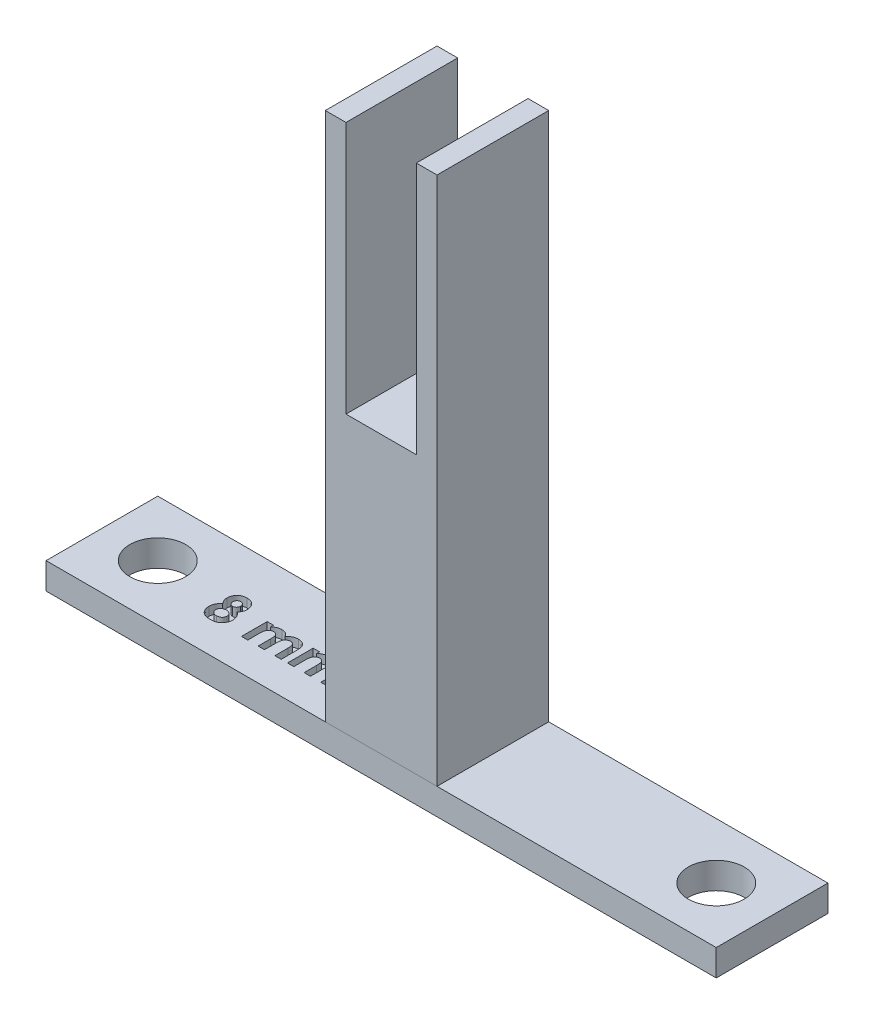
from build123d import *

# Parameters (mm, degrees)
SKETCH1_W           = 12.7
SKETCH1_H           = 80.2
BOSS_EXTRUDE1_DEPTH = 12.7
SKETCH4_W           = 76.2
SKETCH4_H           = 12.7
BOSS_EXTRUDE3_DEPTH = 3
CUT_EXTRUDE5_DEPTH  = 23
SKETCH17_R          = 3.175
CUT_EXTRUDE9_DEPTH  = 3
SKETCH18_R          = 3.175
CUT_EXTRUDE10_DEPTH = 3
SKETCH19_W          = 12.7
SKETCH19_H          = 12.7
CUT_EXTRUDE11_DEPTH = 20
CUT_EXTRUDE12_DEPTH = 1


with BuildPart() as part:
    # Sketch1 → Boss-Extrude1 (new body)
    with BuildSketch(Plane.XY):
        with Locations((6.35, 40.1)):
            Rectangle(SKETCH1_W, SKETCH1_H)
    extrude(amount=BOSS_EXTRUDE1_DEPTH)

    # Sketch4 → Boss-Extrude3 (add)
    with BuildSketch(Plane(origin=(0, 0, 0), x_dir=(-1, 0, 0), z_dir=(0, -1, 0))):
        with Locations((-6.347630067, -6.349948063)):
            Rectangle(SKETCH4_W, SKETCH4_H)
    extrude(amount=BOSS_EXTRUDE3_DEPTH)

    # Sketch12 → Cut-Extrude5 (cut)
    with BuildSketch(Plane.XY.offset(12.7)):
        with BuildLine():
            Line((2.35, 31.479187253), (2.35, 62.124358121))
            ThreePointArc((2.35, 62.124358121), (6.35, 70.085423211), (10.35, 62.124358121))
            Line((10.35, 62.124358121), (10.35, 31.479187253))
            Line((10.35, 31.479187253), (2.35, 31.479187253))
        make_face()
    extrude(amount=-CUT_EXTRUDE5_DEPTH, mode=Mode.SUBTRACT)

    # Sketch17 → Cut-Extrude9 (cut)
    with BuildSketch(Plane(origin=(0, 0, 0), x_dir=(1, 0, 0), z_dir=(0, 1, 0))):
        with Locations(Location((-25.402369933, -6.349948063, 0), (0, 0, 270))):
            Circle(SKETCH17_R)
    extrude(amount=-CUT_EXTRUDE9_DEPTH, mode=Mode.SUBTRACT)

    # Sketch18 → Cut-Extrude10 (cut)
    with BuildSketch(Plane(origin=(0, 0, 0), x_dir=(1, 0, 0), z_dir=(0, 1, 0))):
        with Locations(Location((38.1, -6.349948063, 0), (0, 0, 270))):
            Circle(SKETCH18_R)
    extrude(amount=-CUT_EXTRUDE10_DEPTH, mode=Mode.SUBTRACT)

    # Sketch19 → Cut-Extrude11 (cut)
    with BuildSketch(Plane(origin=(0, 80.2, 0), x_dir=(1, 0, 0), z_dir=(0, 1, 0))):
        with Locations((6.35, -6.35)):
            Rectangle(SKETCH19_W, SKETCH19_H)
    extrude(amount=-CUT_EXTRUDE11_DEPTH, mode=Mode.SUBTRACT)

    # Sketch20 → Cut-Extrude12 (cut)
    # profile 1 of 3: a face of its own
    with BuildSketch(Plane(origin=(0, 0, 0), x_dir=(1, 0, 0), z_dir=(0, 1, 0))):
        with BuildLine():
            Line((-7.948717949, -6.132650635), (-7.230769231, -6.132650635))
            Line((-7.230769231, -6.132650635), (-7.230769231, -6.482009609))
            add(Edge.make_bspline(
                [(-7.230769231, -6.482009609), (-7.198835237, -6.449779032), (-7.135959827, -6.386319675), (-7.031762973, -6.304736966), (-6.923075104, -6.234973671), (-6.808579094, -6.178495893), (-6.688554997, -6.135371031), (-6.563571664, -6.103769767), (-6.432987129, -6.085126012), (-6.344076709, -6.082634943), (-6.298878205, -6.081368583)],
                knots=[0, 0, 0, 0, 1.041528618, 2.050684245, 3.032913108, 4.004406485, 4.976926473, 5.95771665, 6.961784757, 8, 8, 8, 8], degree=3))
            add(Edge.make_bspline(
                [(-6.298878205, -6.081368583), (-6.253620023, -6.082792155), (-6.164530756, -6.085594409), (-6.034550134, -6.111237661), (-5.911414263, -6.15289928), (-5.796477925, -6.2122828), (-5.688910429, -6.28561836), (-5.593477085, -6.376694706), (-5.507575607, -6.481886288), (-5.461786812, -6.561412254), (-5.438301282, -6.602201917)],
                knots=[0, 0, 0, 0, 1.023965777, 2.015643508, 2.987309376, 3.958410333, 4.93654923, 5.924956801, 6.93568961, 8, 8, 8, 8], degree=3))
            add(Edge.make_bspline(
                [(-5.438301282, -6.602201917), (-5.408048884, -6.56130129), (-5.348671917, -6.481024839), (-5.243420834, -6.37621483), (-5.129613012, -6.285608863), (-5.00504653, -6.211741385), (-4.873029444, -6.153101976), (-4.734139443, -6.111392457), (-4.58963575, -6.085637266), (-4.491293058, -6.082803298), (-4.44150641, -6.081368583)],
                knots=[0, 0, 0, 0, 1.041189987, 2.043563759, 3.033412161, 4.015238574, 5.00275396, 5.986226558, 6.980513695, 8, 8, 8, 8], degree=3))
            add(Edge.make_bspline(
                [(-4.44150641, -6.081368583), (-4.390082716, -6.082858314), (-4.289939851, -6.085759425), (-4.144818459, -6.114301282), (-4.008894715, -6.158402733), (-3.885172495, -6.222581139), (-3.773298931, -6.298603002), (-3.677969158, -6.388426005), (-3.598854158, -6.488915841), (-3.547340147, -6.582748828), (-3.514037723, -6.665707933), (-3.493929423, -6.737897899), (-3.475121942, -6.818507127), (-3.461610649, -6.908619117), (-3.448998452, -7.007386887), (-3.441676577, -7.115467079), (-3.436699822, -7.232495595), (-3.436171227, -7.313466988), (-3.435897436, -7.355407045)],
                knots=[0, 0, 0, 0, 1.321991808, 2.574456155, 3.791773975, 4.987670122, 6.148905103, 7.262530793, 8.344737981, 9.427709016, 10.004683293, 10.642050061, 11.354108788, 12.133887687, 12.985666279, 13.916212488, 14.92067847, 16, 16, 16, 16], degree=3))
            Line((-3.435897436, -7.355407045), (-3.435897436, -9.055727558))
            Line((-3.435897436, -9.055727558), (-4.153846154, -9.055727558))
            Line((-4.153846154, -9.055727558), (-4.153846154, -7.58777884))
            add(Edge.make_bspline(
                [(-4.153846154, -7.58777884), (-4.15444371, -7.54851394), (-4.155590666, -7.473148514), (-4.160466815, -7.365051198), (-4.171381722, -7.267016261), (-4.184175393, -7.178500681), (-4.202483382, -7.099973777), (-4.22480665, -7.031246251), (-4.250701506, -6.972219172), (-4.281968764, -6.922898691), (-4.316988129, -6.881363056), (-4.355942122, -6.845758792), (-4.398424586, -6.815381308), (-4.444820688, -6.789488821), (-4.496345886, -6.771977219), (-4.551260772, -6.758236991), (-4.609995071, -6.748879798), (-4.650603952, -6.748321949), (-4.671474359, -6.74803525)],
                knots=[0, 0, 0, 0, 1.669139205, 3.203761885, 4.596586177, 5.860166715, 7.002923539, 8.018877315, 8.928339525, 9.734594377, 10.491888885, 11.231098709, 11.971440889, 12.708030942, 13.480072485, 14.275788656, 15.113863979, 16, 16, 16, 16], degree=3))
            add(Edge.make_bspline(
                [(-4.671474359, -6.74803525), (-4.70363536, -6.749147139), (-4.766744926, -6.751329), (-4.858708425, -6.772179128), (-4.945246756, -6.806266855), (-5.026035709, -6.852640188), (-5.099336887, -6.910559605), (-5.163456862, -6.979257556), (-5.216411019, -7.059129953), (-5.253067177, -7.133235517), (-5.275972672, -7.200241837), (-5.292130417, -7.257627368), (-5.304724736, -7.322521917), (-5.314582401, -7.39426825), (-5.324039679, -7.473271957), (-5.328679367, -7.559433135), (-5.333427184, -7.652632086), (-5.333365377, -7.717044551), (-5.333333333, -7.750439096)],
                knots=[0, 0, 0, 0, 1.129913425, 2.217230253, 3.297175357, 4.391411011, 5.481605898, 6.571841268, 7.681894157, 8.841607612, 9.468549532, 10.170608623, 10.93710061, 11.791434153, 12.717934886, 13.734733707, 14.825576123, 16, 16, 16, 16], degree=3))
            Line((-5.333333333, -7.750439096), (-5.333333333, -9.055727558))
            Line((-5.333333333, -9.055727558), (-6.051282051, -9.055727558))
            Line((-6.051282051, -9.055727558), (-6.051282051, -7.65428525))
            add(Edge.make_bspline(
                [(-6.051282051, -7.65428525), (-6.05134233, -7.623031241), (-6.051458288, -7.562908652), (-6.054943742, -7.476090483), (-6.059559165, -7.39592581), (-6.06602945, -7.322191039), (-6.07349165, -7.254977879), (-6.084261324, -7.194654031), (-6.09557586, -7.140887094), (-6.114974786, -7.079809458), (-6.142310366, -7.012125215), (-6.183150122, -6.940349845), (-6.232530966, -6.880254888), (-6.289204798, -6.831372676), (-6.353248661, -6.794128354), (-6.423040123, -6.766423207), (-6.499911809, -6.751468819), (-6.552825139, -6.749203926), (-6.580128205, -6.74803525)],
                knots=[0, 0, 0, 0, 1.256487322, 2.417074606, 3.49288742, 4.484586665, 5.393016842, 6.210437544, 6.947749329, 7.599905853, 8.784490193, 9.876739139, 10.906602197, 11.896672079, 12.869113195, 13.872201355, 14.902064413, 16, 16, 16, 16], degree=3))
            add(Edge.make_bspline(
                [(-6.580128205, -6.74803525), (-6.610978321, -6.749082356), (-6.672077232, -6.751156159), (-6.761077131, -6.773430499), (-6.846169288, -6.80689278), (-6.925481763, -6.854559535), (-6.997678654, -6.913841973), (-7.061156651, -6.984493979), (-7.113832514, -7.06643175), (-7.150651382, -7.14258141), (-7.173222887, -7.211259445), (-7.18981509, -7.270135046), (-7.201940821, -7.336458718), (-7.212057871, -7.409485765), (-7.221459159, -7.489302385), (-7.226118044, -7.576259582), (-7.230861169, -7.670260971), (-7.230800616, -7.735207097), (-7.230769231, -7.768868583)],
                knots=[0, 0, 0, 0, 1.07893236, 2.136834559, 3.195274846, 4.273923004, 5.364443877, 6.458052972, 7.587287137, 8.767908, 9.410170275, 10.118584836, 10.909717261, 11.770069756, 12.702352573, 13.724628867, 14.820678298, 16, 16, 16, 16], degree=3))
            Line((-7.230769231, -7.768868583), (-7.230769231, -9.055727558))
            Line((-7.230769231, -9.055727558), (-7.948717949, -9.055727558))
            Line((-7.948717949, -9.055727558), (-7.948717949, -6.132650635))
        make_face()
    # profile 2 of 3: a face of its own
    with BuildSketch(Plane(origin=(0, 0, 0), x_dir=(1, 0, 0), z_dir=(0, 1, 0))):
        with BuildLine():
            Line((-13.179487179, -6.132650635), (-12.461538462, -6.132650635))
            Line((-12.461538462, -6.132650635), (-12.461538462, -6.482009609))
            add(Edge.make_bspline(
                [(-12.461538462, -6.482009609), (-12.429604467, -6.449779032), (-12.366729057, -6.386319675), (-12.262532204, -6.304736966), (-12.153844334, -6.234973671), (-12.039348325, -6.178495893), (-11.919324228, -6.135371031), (-11.794340895, -6.103769767), (-11.663756359, -6.085126012), (-11.57484594, -6.082634943), (-11.529647436, -6.081368583)],
                knots=[0, 0, 0, 0, 1.041528618, 2.050684245, 3.032913108, 4.004406485, 4.976926473, 5.95771665, 6.961784757, 8, 8, 8, 8], degree=3))
            add(Edge.make_bspline(
                [(-11.529647436, -6.081368583), (-11.484389254, -6.082792155), (-11.395299986, -6.085594409), (-11.265319365, -6.111237661), (-11.142183493, -6.15289928), (-11.027247156, -6.2122828), (-10.919679659, -6.28561836), (-10.824246316, -6.376694706), (-10.738344838, -6.481886288), (-10.692556043, -6.561412254), (-10.669070513, -6.602201917)],
                knots=[0, 0, 0, 0, 1.023965777, 2.015643508, 2.987309376, 3.958410333, 4.93654923, 5.924956801, 6.93568961, 8, 8, 8, 8], degree=3))
            add(Edge.make_bspline(
                [(-10.669070513, -6.602201917), (-10.638818115, -6.56130129), (-10.579441148, -6.481024839), (-10.474190065, -6.37621483), (-10.360382242, -6.285608863), (-10.235815761, -6.211741385), (-10.103798675, -6.153101976), (-9.964908673, -6.111392457), (-9.820404981, -6.085637266), (-9.722062288, -6.082803298), (-9.672275641, -6.081368583)],
                knots=[0, 0, 0, 0, 1.041189987, 2.043563759, 3.033412161, 4.015238574, 5.00275396, 5.986226558, 6.980513695, 8, 8, 8, 8], degree=3))
            add(Edge.make_bspline(
                [(-9.672275641, -6.081368583), (-9.620851946, -6.082858314), (-9.520709082, -6.085759425), (-9.37558769, -6.114301282), (-9.239663946, -6.158402733), (-9.115941726, -6.222581139), (-9.004068161, -6.298603002), (-8.908738389, -6.388426005), (-8.829623388, -6.488915841), (-8.778109378, -6.582748828), (-8.744806954, -6.665707933), (-8.724698654, -6.737897899), (-8.705891173, -6.818507127), (-8.692379879, -6.908619117), (-8.679767683, -7.007386887), (-8.672445807, -7.115467079), (-8.667469052, -7.232495595), (-8.666940458, -7.313466988), (-8.666666667, -7.355407045)],
                knots=[0, 0, 0, 0, 1.321991808, 2.574456155, 3.791773975, 4.987670122, 6.148905103, 7.262530793, 8.344737981, 9.427709016, 10.004683293, 10.642050061, 11.354108788, 12.133887687, 12.985666279, 13.916212488, 14.92067847, 16, 16, 16, 16], degree=3))
            Line((-8.666666667, -7.355407045), (-8.666666667, -9.055727558))
            Line((-8.666666667, -9.055727558), (-9.384615385, -9.055727558))
            Line((-9.384615385, -9.055727558), (-9.384615385, -7.58777884))
            add(Edge.make_bspline(
                [(-9.384615385, -7.58777884), (-9.385212941, -7.54851394), (-9.386359896, -7.473148514), (-9.391236045, -7.365051198), (-9.402150953, -7.267016261), (-9.414944624, -7.178500681), (-9.433252613, -7.099973777), (-9.455575881, -7.031246251), (-9.481470737, -6.972219172), (-9.512737995, -6.922898691), (-9.54775736, -6.881363056), (-9.586711352, -6.845758792), (-9.629193816, -6.815381308), (-9.675589918, -6.789488821), (-9.727115117, -6.771977219), (-9.782030003, -6.758236991), (-9.840764302, -6.748879798), (-9.881373183, -6.748321949), (-9.90224359, -6.74803525)],
                knots=[0, 0, 0, 0, 1.669139205, 3.203761885, 4.596586177, 5.860166715, 7.002923539, 8.018877315, 8.928339525, 9.734594377, 10.491888885, 11.231098709, 11.971440889, 12.708030942, 13.480072485, 14.275788656, 15.113863979, 16, 16, 16, 16], degree=3))
            add(Edge.make_bspline(
                [(-9.90224359, -6.74803525), (-9.934404591, -6.749147139), (-9.997514157, -6.751329), (-10.089477656, -6.772179128), (-10.176015986, -6.806266855), (-10.25680494, -6.852640188), (-10.330106118, -6.910559605), (-10.394226093, -6.979257556), (-10.44718025, -7.059129953), (-10.483836408, -7.133235517), (-10.506741903, -7.200241837), (-10.522899647, -7.257627368), (-10.535493967, -7.322521917), (-10.545351632, -7.39426825), (-10.55480891, -7.473271957), (-10.559448598, -7.559433135), (-10.564196414, -7.652632086), (-10.564134608, -7.717044551), (-10.564102564, -7.750439096)],
                knots=[0, 0, 0, 0, 1.129913425, 2.217230253, 3.297175357, 4.391411011, 5.481605898, 6.571841268, 7.681894157, 8.841607612, 9.468549532, 10.170608623, 10.93710061, 11.791434153, 12.717934886, 13.734733707, 14.825576123, 16, 16, 16, 16], degree=3))
            Line((-10.564102564, -7.750439096), (-10.564102564, -9.055727558))
            Line((-10.564102564, -9.055727558), (-11.282051282, -9.055727558))
            Line((-11.282051282, -9.055727558), (-11.282051282, -7.65428525))
            add(Edge.make_bspline(
                [(-11.282051282, -7.65428525), (-11.282111561, -7.623031241), (-11.282227519, -7.562908652), (-11.285712973, -7.476090483), (-11.290328396, -7.39592581), (-11.296798681, -7.322191039), (-11.304260881, -7.254977879), (-11.315030555, -7.194654031), (-11.326345091, -7.140887094), (-11.345744017, -7.079809458), (-11.373079597, -7.012125215), (-11.413919353, -6.940349845), (-11.463300197, -6.880254888), (-11.519974029, -6.831372676), (-11.584017892, -6.794128354), (-11.653809354, -6.766423207), (-11.73068104, -6.751468819), (-11.78359437, -6.749203926), (-11.810897436, -6.74803525)],
                knots=[0, 0, 0, 0, 1.256487322, 2.417074606, 3.49288742, 4.484586665, 5.393016842, 6.210437544, 6.947749329, 7.599905853, 8.784490193, 9.876739139, 10.906602197, 11.896672079, 12.869113195, 13.872201355, 14.902064413, 16, 16, 16, 16], degree=3))
            add(Edge.make_bspline(
                [(-11.810897436, -6.74803525), (-11.841747551, -6.749082356), (-11.902846463, -6.751156159), (-11.991846362, -6.773430499), (-12.076938519, -6.80689278), (-12.156250994, -6.854559535), (-12.228447884, -6.913841973), (-12.291925882, -6.984493979), (-12.344601745, -7.06643175), (-12.381420613, -7.14258141), (-12.403992118, -7.211259445), (-12.420584321, -7.270135046), (-12.432710052, -7.336458718), (-12.442827102, -7.409485765), (-12.452228389, -7.489302385), (-12.456887275, -7.576259582), (-12.4616304, -7.670260971), (-12.461569846, -7.735207097), (-12.461538462, -7.768868583)],
                knots=[0, 0, 0, 0, 1.07893236, 2.136834559, 3.195274846, 4.273923004, 5.364443877, 6.458052972, 7.587287137, 8.767908, 9.410170275, 10.118584836, 10.909717261, 11.770069756, 12.702352573, 13.724628867, 14.820678298, 16, 16, 16, 16], degree=3))
            Line((-12.461538462, -7.768868583), (-12.461538462, -9.055727558))
            Line((-12.461538462, -9.055727558), (-13.179487179, -9.055727558))
            Line((-13.179487179, -9.055727558), (-13.179487179, -6.132650635))
        make_face()
    # profile 3 of 3: a face of its own
    with BuildSketch(Plane(origin=(0, 0, 0), x_dir=(1, 0, 0), z_dir=(0, 1, 0))):
        with BuildLine():
            add(Edge.make_bspline(
                [(-15.830128205, -6.901881404), (-15.788183167, -6.931852267), (-15.705156748, -6.991176886), (-15.59550922, -7.09745916), (-15.501064472, -7.216018269), (-15.422814276, -7.346126995), (-15.36012258, -7.484587233), (-15.315244837, -7.629919007), (-15.28673901, -7.780840456), (-15.283625323, -7.883591988), (-15.282051282, -7.93553525)],
                knots=[0, 0, 0, 0, 1.013736912, 2.006600758, 2.994453809, 3.989973287, 4.987781207, 5.978959008, 6.978317308, 8, 8, 8, 8], degree=3))
            add(Edge.make_bspline(
                [(-15.282051282, -7.93553525), (-15.283950242, -7.99178066), (-15.287716586, -8.103336212), (-15.321016096, -8.266932411), (-15.374477123, -8.424101177), (-15.44754205, -8.573107765), (-15.53915203, -8.709321619), (-15.645931982, -8.829909699), (-15.768016511, -8.931722637), (-15.881680665, -9.00080206), (-15.979515373, -9.046690214), (-16.058467125, -9.076057711), (-16.141834984, -9.101911684), (-16.230213853, -9.122567292), (-16.323587661, -9.138692384), (-16.421823152, -9.149341365), (-16.524984993, -9.157082525), (-16.595337007, -9.157881819), (-16.631410256, -9.15829166)],
                knots=[0, 0, 0, 0, 1.313679292, 2.605514271, 3.884962679, 5.186178731, 6.472827995, 7.711026938, 8.938935107, 10.174644318, 10.808706728, 11.462743532, 12.142127587, 12.847854939, 13.582806024, 14.355735269, 15.156897313, 16, 16, 16, 16], degree=3))
            add(Edge.make_bspline(
                [(-16.631410256, -9.15829166), (-16.669878798, -9.157769851), (-16.745000276, -9.156750861), (-16.8546609, -9.150589505), (-16.958103264, -9.139230355), (-17.055544357, -9.124276914), (-17.14689043, -9.104489177), (-17.232144188, -9.079399411), (-17.311511486, -9.05083192), (-17.408661228, -9.007335464), (-17.519685766, -8.939406433), (-17.639683214, -8.839926326), (-17.745010271, -8.72144241), (-17.836582173, -8.587280511), (-17.908762598, -8.438265994), (-17.962438112, -8.279075939), (-17.994225388, -8.11014173), (-17.998052221, -7.994430102), (-18, -7.93553525)],
                knots=[0, 0, 0, 0, 0.886964665, 1.7320671, 2.531131818, 3.285397207, 4.004107883, 4.684213108, 5.332925796, 5.947568694, 7.135706876, 8.320776993, 9.52873045, 10.778999824, 12.05415135, 13.333578234, 14.642845846, 16, 16, 16, 16], degree=3))
            add(Edge.make_bspline(
                [(-18, -7.93553525), (-17.998220056, -7.88415918), (-17.994722251, -7.783198982), (-17.969666997, -7.635260362), (-17.92670485, -7.494997046), (-17.867754098, -7.361432577), (-17.791738104, -7.234552095), (-17.698207354, -7.115289189), (-17.588347723, -7.002567943), (-17.505039111, -6.936000287), (-17.462339744, -6.901881404)],
                knots=[0, 0, 0, 0, 1.01821053, 2.000906977, 2.963938143, 3.919209931, 4.888045165, 5.887808425, 6.917407893, 8, 8, 8, 8], degree=3))
            add(Edge.make_bspline(
                [(-17.462339744, -6.901881404), (-17.488811087, -6.871350582), (-17.540925189, -6.81124459), (-17.60836135, -6.714508785), (-17.665173477, -6.614774069), (-17.713409677, -6.512849841), (-17.749067105, -6.40698122), (-17.776032342, -6.298832679), (-17.791283853, -6.18730243), (-17.79366771, -6.112127728), (-17.794871795, -6.074157045)],
                knots=[0, 0, 0, 0, 1.061529281, 2.089831458, 3.092927091, 4.075998741, 5.048384512, 6.024008542, 7.00192825, 8, 8, 8, 8], degree=3))
            add(Edge.make_bspline(
                [(-17.794871795, -6.074157045), (-17.793275362, -6.022755934), (-17.790125662, -5.921343521), (-17.762228947, -5.773054629), (-17.715913628, -5.632150627), (-17.652905578, -5.49904406), (-17.572895146, -5.376635843), (-17.477825432, -5.266863036), (-17.366359941, -5.173746574), (-17.242643776, -5.09384854), (-17.106056813, -5.030298385), (-16.957894975, -4.985830746), (-16.799947339, -4.957680386), (-16.691094542, -4.954692004), (-16.635416667, -4.953163455)],
                knots=[0, 0, 0, 0, 1.022455555, 2.017265428, 2.990720743, 3.968117071, 4.939886797, 5.893155559, 6.847550415, 7.820889576, 8.817530429, 9.83499769, 10.892607882, 12, 12, 12, 12], degree=3))
            add(Edge.make_bspline(
                [(-16.635416667, -4.953163455), (-16.580540698, -4.954694505), (-16.473544049, -4.957679732), (-16.318372131, -4.985643567), (-16.173412099, -5.031101732), (-16.039862667, -5.095993714), (-15.917425968, -5.176045743), (-15.807854918, -5.272404433), (-15.713083535, -5.384911309), (-15.632408966, -5.510486191), (-15.568123732, -5.645774932), (-15.520597885, -5.787653262), (-15.493108374, -5.935006005), (-15.489163686, -6.035051565), (-15.487179487, -6.085374994)],
                knots=[0, 0, 0, 0, 1.094655142, 2.134348324, 3.136019022, 4.118575226, 5.088726318, 6.048298823, 7.020513804, 8.015920439, 9.020015034, 10.003048569, 10.995523219, 12, 12, 12, 12], degree=3))
            add(Edge.make_bspline(
                [(-15.487179487, -6.085374994), (-15.488135323, -6.120940871), (-15.49001108, -6.190736247), (-15.503880048, -6.293564533), (-15.527233688, -6.392228412), (-15.559793949, -6.489112184), (-15.605063827, -6.58684872), (-15.666324498, -6.687310831), (-15.74084006, -6.794672737), (-15.799360854, -6.86493891), (-15.830128205, -6.901881404)],
                knots=[0, 0, 0, 0, 0.940746401, 1.846144481, 2.739104268, 3.619506754, 4.545839139, 5.581956076, 6.728711598, 8, 8, 8, 8], degree=3))
        make_face()
        with BuildLine():
            add(Edge.make_bspline(
                [(-16.653044872, -5.671112173), (-16.68260432, -5.672537212), (-16.740103977, -5.675309228), (-16.822149255, -5.700329738), (-16.895910636, -5.741252563), (-16.959704373, -5.797570424), (-17.012018562, -5.86590371), (-17.050466617, -5.944466787), (-17.073266768, -6.032290098), (-17.075680607, -6.093785645), (-17.076923077, -6.125439096)],
                knots=[0, 0, 0, 0, 1.018099191, 1.980427864, 2.929421084, 3.909248076, 4.895556904, 5.880788387, 6.909183412, 8, 8, 8, 8], degree=3))
            add(Edge.make_bspline(
                [(-17.076923077, -6.125439096), (-17.075388247, -6.157362875), (-17.072391344, -6.219697129), (-17.048824067, -6.309207811), (-17.008652992, -6.390329944), (-16.953498377, -6.461369153), (-16.886476589, -6.519391925), (-16.811432731, -6.563706488), (-16.727534555, -6.589004523), (-16.669233374, -6.592435027), (-16.639423077, -6.594189096)],
                knots=[0, 0, 0, 0, 1.07118507, 2.091592095, 3.082435519, 4.092579768, 5.090825648, 6.043203473, 6.999459622, 8, 8, 8, 8], degree=3))
            add(Edge.make_bspline(
                [(-16.639423077, -6.594189096), (-16.609049201, -6.592829993), (-16.549875191, -6.590182205), (-16.465767532, -6.564227756), (-16.38999728, -6.522718906), (-16.325111254, -6.464034574), (-16.271365691, -6.392969638), (-16.232224039, -6.310429824), (-16.209695518, -6.21796595), (-16.206687881, -6.15334219), (-16.205128205, -6.119830122)],
                knots=[0, 0, 0, 0, 1.008803858, 1.965339183, 2.900766489, 3.864508618, 4.855158575, 5.849593072, 6.884859315, 8, 8, 8, 8], degree=3))
            add(Edge.make_bspline(
                [(-16.205128205, -6.119830122), (-16.206727335, -6.088197595), (-16.209819995, -6.027021401), (-16.231995556, -5.939192393), (-16.272722081, -5.861855499), (-16.326231481, -5.793946547), (-16.393317929, -5.739182202), (-16.47120038, -5.698908172), (-16.559305343, -5.675548845), (-16.621121716, -5.672623089), (-16.653044872, -5.671112173)],
                knots=[0, 0, 0, 0, 1.065910571, 2.061433587, 3.023559535, 3.990682701, 4.956464619, 5.918590567, 6.925120432, 8, 8, 8, 8], degree=3))
        make_face(mode=Mode.SUBTRACT)
        with BuildLine():
            add(Edge.make_bspline(
                [(-16.629807692, -7.312137814), (-16.652270635, -7.312510845), (-16.696544815, -7.313246084), (-16.761631498, -7.321724488), (-16.824088859, -7.334359409), (-16.88383941, -7.351788925), (-16.940581294, -7.375549742), (-16.994795496, -7.404193846), (-17.046294782, -7.438010792), (-17.094315276, -7.476386634), (-17.137714581, -7.518507777), (-17.176835106, -7.562438764), (-17.208810613, -7.609315329), (-17.235438586, -7.657579282), (-17.256834313, -7.707613086), (-17.270978506, -7.760240697), (-17.280085386, -7.814761262), (-17.281392128, -7.85189846), (-17.282051282, -7.870631404)],
                knots=[0, 0, 0, 0, 1.129580664, 2.226389355, 3.296443603, 4.333934503, 5.352185725, 6.386189251, 7.41493955, 8.447544828, 9.47401038, 10.455044306, 11.4018853, 12.322125673, 13.225630306, 14.132028716, 15.057747923, 16, 16, 16, 16], degree=3))
            add(Edge.make_bspline(
                [(-17.282051282, -7.870631404), (-17.281737118, -7.890168015), (-17.281114011, -7.928916466), (-17.271702866, -7.98547296), (-17.258152478, -8.040017815), (-17.239120525, -8.092040457), (-17.213668905, -8.141510599), (-17.183279208, -8.188909199), (-17.146891758, -8.233903888), (-17.105493189, -8.276253422), (-17.059147675, -8.314460261), (-17.009197368, -8.348121152), (-16.956301996, -8.377798316), (-16.89887368, -8.399172986), (-16.839039217, -8.418736961), (-16.775195625, -8.430605954), (-16.708040218, -8.439339488), (-16.662157843, -8.440002725), (-16.638621795, -8.440342942)],
                knots=[0, 0, 0, 0, 0.973817353, 1.931446211, 2.852767904, 3.776304432, 4.688323523, 5.623710549, 6.581246645, 7.570897993, 8.57436511, 9.572506873, 10.574556662, 11.591826551, 12.624694332, 13.712108235, 14.826391851, 16, 16, 16, 16], degree=3))
            add(Edge.make_bspline(
                [(-16.638621795, -8.440342942), (-16.614830352, -8.439911694), (-16.568468365, -8.439071328), (-16.500696462, -8.431644084), (-16.43659627, -8.419859208), (-16.376244353, -8.403004091), (-16.319412489, -8.381412014), (-16.26686303, -8.353929572), (-16.217396183, -8.322784319), (-16.17260157, -8.286397348), (-16.131700787, -8.246743145), (-16.09645902, -8.20328551), (-16.066493336, -8.157421885), (-16.042322746, -8.108656713), (-16.022819251, -8.057220184), (-16.009441077, -8.002599423), (-16.001139439, -7.94540824), (-16.000383891, -7.906451028), (-16, -7.886657045)],
                knots=[0, 0, 0, 0, 1.200705402, 2.339794563, 3.437264955, 4.487414319, 5.499029866, 6.500076882, 7.476298407, 8.444948224, 9.407950986, 10.347155707, 11.263432813, 12.167927724, 13.089546445, 14.03463663, 15.00140776, 16, 16, 16, 16], degree=3))
            add(Edge.make_bspline(
                [(-16, -7.886657045), (-16.000733005, -7.866604284), (-16.002165776, -7.827408084), (-16.010005687, -7.769525677), (-16.024712561, -7.714652251), (-16.043953448, -7.661515152), (-16.069548246, -7.611213964), (-16.101323633, -7.563854848), (-16.137491823, -7.518264663), (-16.179764447, -7.476472917), (-16.225982987, -7.438260407), (-16.275175256, -7.404217255), (-16.327189736, -7.375385845), (-16.382168705, -7.3518176), (-16.440313041, -7.33435034), (-16.501179103, -7.321724932), (-16.564667046, -7.313244186), (-16.607878161, -7.312510273), (-16.629807692, -7.312137814)],
                knots=[0, 0, 0, 0, 1.011708178, 1.977538892, 2.938094892, 3.871441737, 4.823268678, 5.775953079, 6.743660653, 7.753304209, 8.767430709, 9.76505158, 10.765940967, 11.761741361, 12.775867861, 13.822051386, 14.89469657, 16, 16, 16, 16], degree=3))
        make_face(mode=Mode.SUBTRACT)
    extrude(amount=-CUT_EXTRUDE12_DEPTH, mode=Mode.SUBTRACT)


solid = part.part
